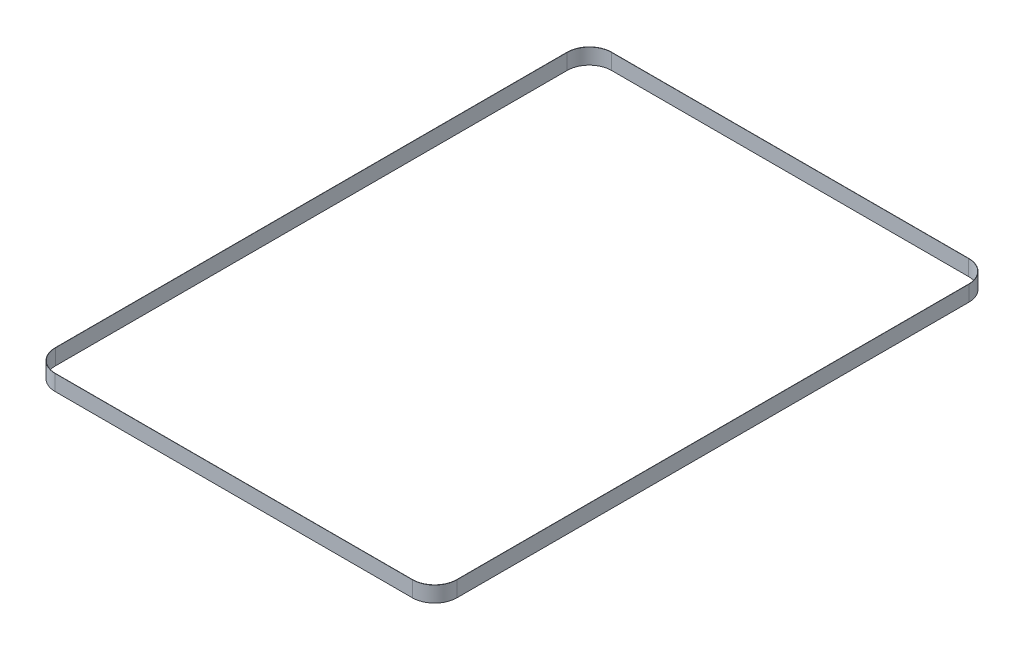
from build123d import *

# Parameters (mm, degrees)
BOSS_EXTRU_1_DEPTH = 7


with BuildPart() as part:
    # Esquisse → Boss.-Extru.1 (new body)
    with BuildSketch(Plane(origin=(0, 0, 0), x_dir=(1, 0, 0), z_dir=(0, 1, 0))):
        with BuildLine():
            Line((-10, 0), (-169.5, 0))
            ThreePointArc((-169.5, 0), (-176.571067812, 2.928932188), (-179.5, 10))
            Line((-179.5, 10), (-179.5, 238.6))
            ThreePointArc((-179.5, 238.6), (-176.571067812, 245.671067812), (-169.5, 248.6))
            Line((-169.5, 248.6), (-10, 248.6))
            ThreePointArc((-10, 248.6), (-2.928932188, 245.671067812), (0, 238.6))
            Line((0, 238.6), (0, 10))
            ThreePointArc((0, 10), (-2.928932188, 2.928932188), (-10, 0))
        make_face()
        with BuildLine():
            Line((-0.1, 10), (-0.1, 238.6))
            ThreePointArc((-0.1, 238.6), (-2.999642866, 245.600357134), (-10, 248.5))
            Line((-10, 248.5), (-169.5, 248.5))
            ThreePointArc((-169.5, 248.5), (-176.500357134, 245.600357134), (-179.4, 238.6))
            Line((-179.4, 238.6), (-179.4, 10))
            ThreePointArc((-179.4, 10), (-176.500357134, 2.999642866), (-169.5, 0.1))
            Line((-169.5, 0.1), (-10, 0.1))
            ThreePointArc((-10, 0.1), (-2.999642866, 2.999642866), (-0.1, 10))
        make_face(mode=Mode.SUBTRACT)
    extrude(amount=BOSS_EXTRU_1_DEPTH)


solid = part.part
